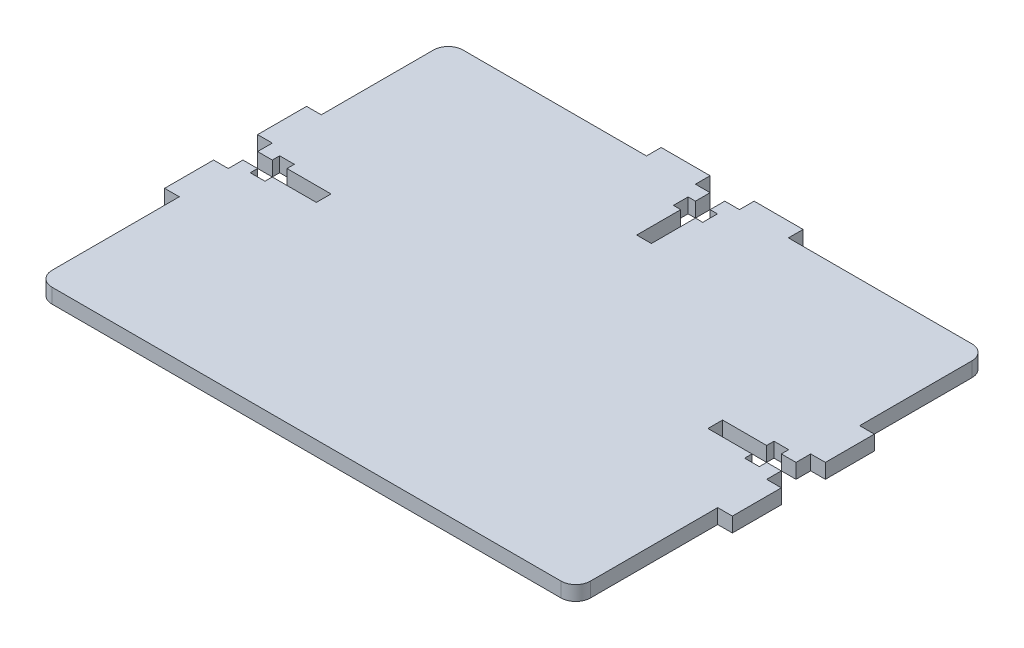
from build123d import *

# Parameters (mm, degrees)
SKETCH1_W           = 3
SKETCH1_H           = 10
SKETCH1_W_2         = 10
SKETCH1_H_2         = 3
BOSS_EXTRUDE1_DEPTH = 3
FILLET1_R           = 3


with BuildPart() as part:
    # Sketch1 → Boss-Extrude1 (new body)
    with BuildSketch(Plane(origin=(0, 0, 0), x_dir=(1, 0, 0), z_dir=(0, 1, 0))):
        Polygon((0, 29), (0, 0), (100, 0), (110, 0), (110, 29), (110, 39), (110, 42), (107, 42), (107, 40.5), (104, 40.5), (104, 42), (95, 42), (95, 45), (104, 45), (104, 46.5), (107, 46.5), (107, 45), (110, 45), (110, 48), (110, 58), (110, 83.95), (69.5, 83.95), (59.5, 83.95), (56.5, 83.95), (56.5, 80.95), (58, 80.95), (58, 77.95), (56.5, 77.95), (56.5, 68.95), (53.5, 68.95), (53.5, 77.95), (52, 77.95), (52, 80.95), (53.5, 80.95), (53.5, 83.95), (50.5, 83.95), (40.5, 83.95), (0, 83.95), (0, 58), (0, 48), (0, 45), (3, 45), (3, 46.5), (6, 46.5), (6, 45), (15, 45), (15, 42), (6, 42), (6, 40.5), (3, 40.5), (3, 42), (0, 42), (0, 39), align=None)
        with Locations((-1.5, 53)):
            Rectangle(SKETCH1_W, SKETCH1_H)
        with Locations((-1.5, 34)):
            Rectangle(SKETCH1_W, SKETCH1_H)
        with Locations((45.5, 85.45)):
            Rectangle(SKETCH1_W_2, SKETCH1_H_2)
        with Locations((64.5, 85.45)):
            Rectangle(SKETCH1_W_2, SKETCH1_H_2)
        with Locations((111.5, 53)):
            Rectangle(SKETCH1_W, SKETCH1_H)
        with Locations((111.5, 34)):
            Rectangle(SKETCH1_W, SKETCH1_H)
    extrude(amount=BOSS_EXTRUDE1_DEPTH)

    # Fillet1
    fillet1_edges = [part.edges().sort_by_distance(p)[0] for p in [
        (110, 1.5, -83.95),
        (110, 1.5, 0),
        (0, 1.5, 0),
        (0, 1.5, -83.95),
    ]]
    fillet(fillet1_edges, radius=FILLET1_R)


solid = part.part
